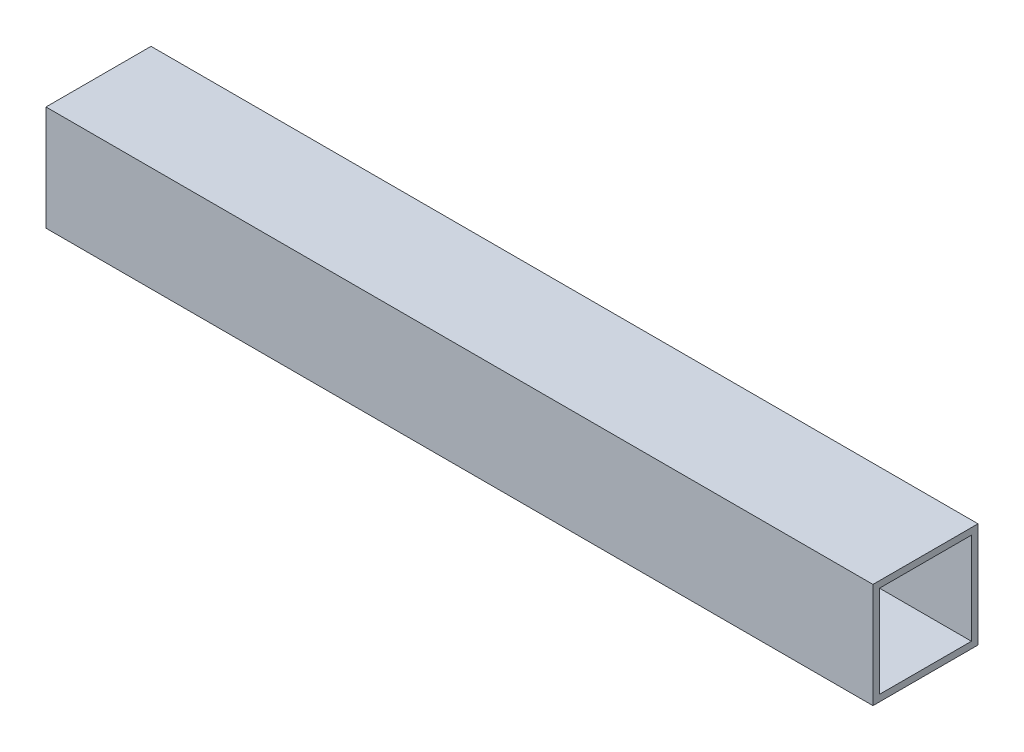
from build123d import *

# Parameters (mm, degrees)
SKETCH2_W           = 25.4
SKETCH2_H           = 25.4
SKETCH2_W_2         = 22.225
SKETCH2_H_2         = 22.225
BOSS_EXTRUDE2_DEPTH = 200


with BuildPart() as part:
    # Sketch2 → Boss-Extrude2 (new body)
    with BuildSketch(Plane(origin=(0, 0, 0), x_dir=(0, 0, -1), z_dir=(1, 0, 0))):
        Rectangle(SKETCH2_W, SKETCH2_H)
        Rectangle(SKETCH2_W_2, SKETCH2_H_2, mode=Mode.SUBTRACT)
    extrude(amount=BOSS_EXTRUDE2_DEPTH)


solid = part.part
